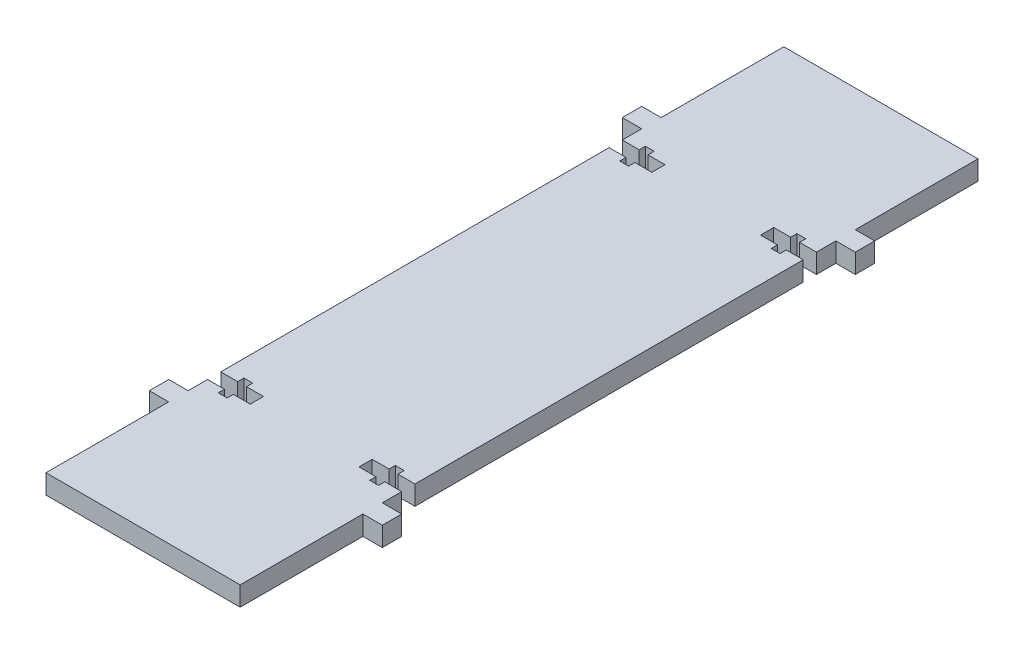
from build123d import *

# Parameters (mm, degrees)
BOSS_EXTRUDE1_DEPTH = 6.35


with BuildPart() as part:
    # Elevator Belt Backplate → Boss-Extrude1 (new body)
    with BuildSketch(Plane(origin=(0, 0, 0), x_dir=(1, 0, 0), z_dir=(0, 1, 0))):
        Polygon((-31.75, -120.65), (31.75, -120.65), (31.75, -80.518), (38.1, -80.518), (38.1, -74.168), (31.75, -74.168), (31.75, -67.818), (26.215000021, -67.818), (26.215000021, -69.858999982), (23.314999979, -69.858999982), (23.314999979, -67.818), (17.78, -67.818), (17.78, -63.5), (23.314999979, -63.5), (23.314999979, -61.459000018), (26.215000021, -61.459000018), (26.215000021, -63.5), (31.75, -63.5), (31.75, 63.5), (26.215000021, 63.5), (26.215000021, 61.459000018), (23.314999979, 61.459000018), (23.314999979, 63.5), (17.78, 63.5), (17.78, 67.818), (23.314999979, 67.818), (23.314999979, 69.858999982), (26.215000021, 69.858999982), (26.215000021, 67.818), (31.75, 67.818), (31.75, 74.168), (38.1, 74.168), (38.1, 80.518), (31.75, 80.518), (31.75, 120.65), (-31.75, 120.65), (-31.75, 80.518), (-38.1, 80.518), (-38.1, 74.168), (-31.75, 74.168), (-31.75, 67.818), (-26.215000021, 67.818), (-26.215000021, 69.858999982), (-23.314999979, 69.858999982), (-23.314999979, 67.818), (-17.78, 67.818), (-17.78, 63.5), (-23.314999979, 63.5), (-23.314999979, 61.459000018), (-26.215000021, 61.459000018), (-26.215000021, 63.5), (-31.75, 63.5), (-31.75, -63.5), (-26.215000021, -63.5), (-26.215000021, -61.459000018), (-23.314999979, -61.459000018), (-23.314999979, -63.5), (-17.78, -63.5), (-17.78, -67.818), (-23.314999979, -67.818), (-23.314999979, -69.858999982), (-26.215000021, -69.858999982), (-26.215000021, -67.818), (-31.75, -67.818), (-31.75, -74.168), (-38.1, -74.168), (-38.1, -80.518), (-31.75, -80.518), align=None)
    extrude(amount=BOSS_EXTRUDE1_DEPTH)


solid = part.part
